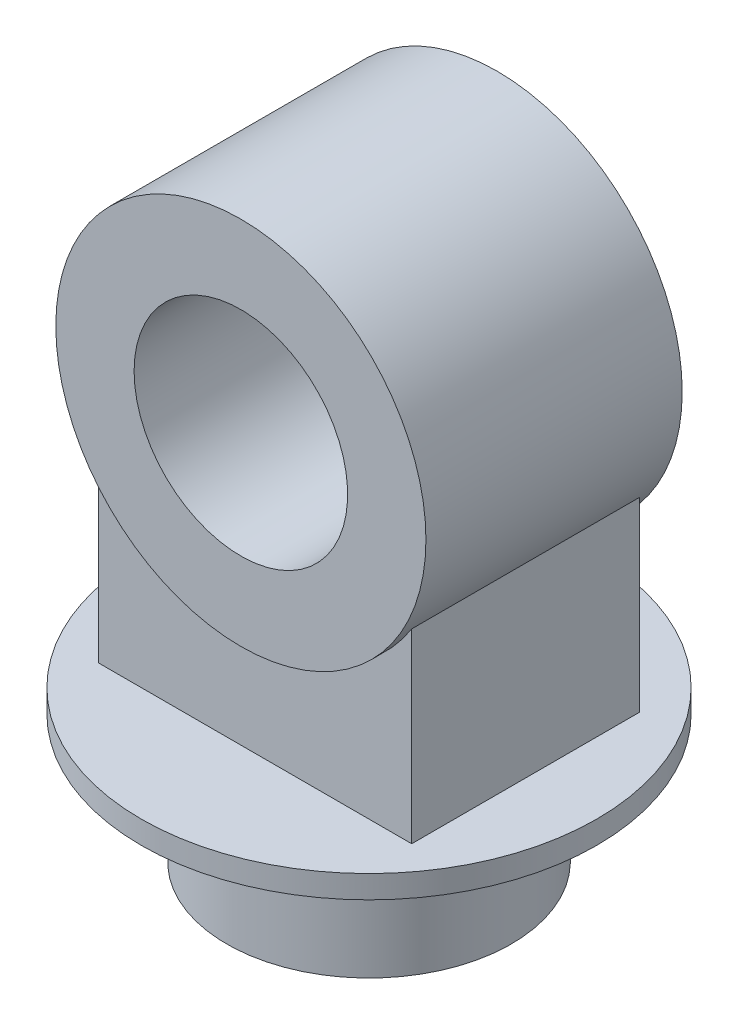
from build123d import *

# Parameters (mm, degrees)
SKETCH1_R                = 100
BOSS_EXTRUDE1_DEPTH      = 90
SKETCH2_R                = 160
BOSS_EXTRUDE2_DEPTH      = 16
SKETCH3_R                = 130
SKETCH3_R_2              = 75
BOSS_EXTRUDE3_DEPTH      = 90
BOSS_EXTRUDE4_REACH      = 402.125
BOSS_EXTRUDE4_END_RADIUS = 130
SKETCH4_W                = 220
SKETCH4_H                = 160


with BuildPart() as part:
    # Sketch1 → Boss-Extrude1 (new body)
    with BuildSketch(Plane(origin=(0, 0, 0), x_dir=(1, 0, 0), z_dir=(0, 1, 0))):
        with Locations(Location((0, 0, 0), (0, 0, 90))):
            Circle(SKETCH1_R)
    extrude(amount=BOSS_EXTRUDE1_DEPTH)

    # Sketch2 → Boss-Extrude2 (add)
    with BuildSketch(Plane(origin=(0, 90, 0), x_dir=(1, 0, 0), z_dir=(0, 1, 0))):
        with Locations(Location((0, 0, 0), (0, 0, 270))):
            Circle(SKETCH2_R)
    extrude(amount=BOSS_EXTRUDE2_DEPTH)



with BuildPart() as body_2:
    # Sketch3 → Boss-Extrude3 (new, symmetric)
    with BuildSketch(Plane.XY):
        with Locations(Location((0, 306, 0), (0, 0, 180))):
            Circle(SKETCH3_R)
        with Locations(Location((0, 306, 0), (0, 0, 180))):
            Circle(SKETCH3_R_2, mode=Mode.SUBTRACT)
    extrude(amount=BOSS_EXTRUDE3_DEPTH, both=True)


with BuildPart() as part_1:
    add(part.part)

    add(body_2.part)  # Boss-Extrude4 merges body 2
    # Boss-Extrude4: up to this cylinder (the profile starts outside it)
    boss_extrude4_end = Plane(origin=(0, 306, 0), z_dir=(0, 0, -1)) * Cylinder(BOSS_EXTRUDE4_END_RADIUS, 1065.25, mode=Mode.PRIVATE)
    # Sketch4 → Boss-Extrude4 (add, up to the surface)
    with BuildSketch(Plane(origin=(0, 106, 0), x_dir=(1, 0, 0), z_dir=(0, 1, 0)), mode=Mode.PRIVATE) as boss_extrude4_sk1:
        Rectangle(SKETCH4_W, SKETCH4_H)
    boss_extrude4_tool1 = extrude(boss_extrude4_sk1.sketch, amount=BOSS_EXTRUDE4_REACH, mode=Mode.PRIVATE) - boss_extrude4_end
    add(boss_extrude4_tool1.solids().sort_by_distance((0, 106, 0))[0])


solid = part_1.part
